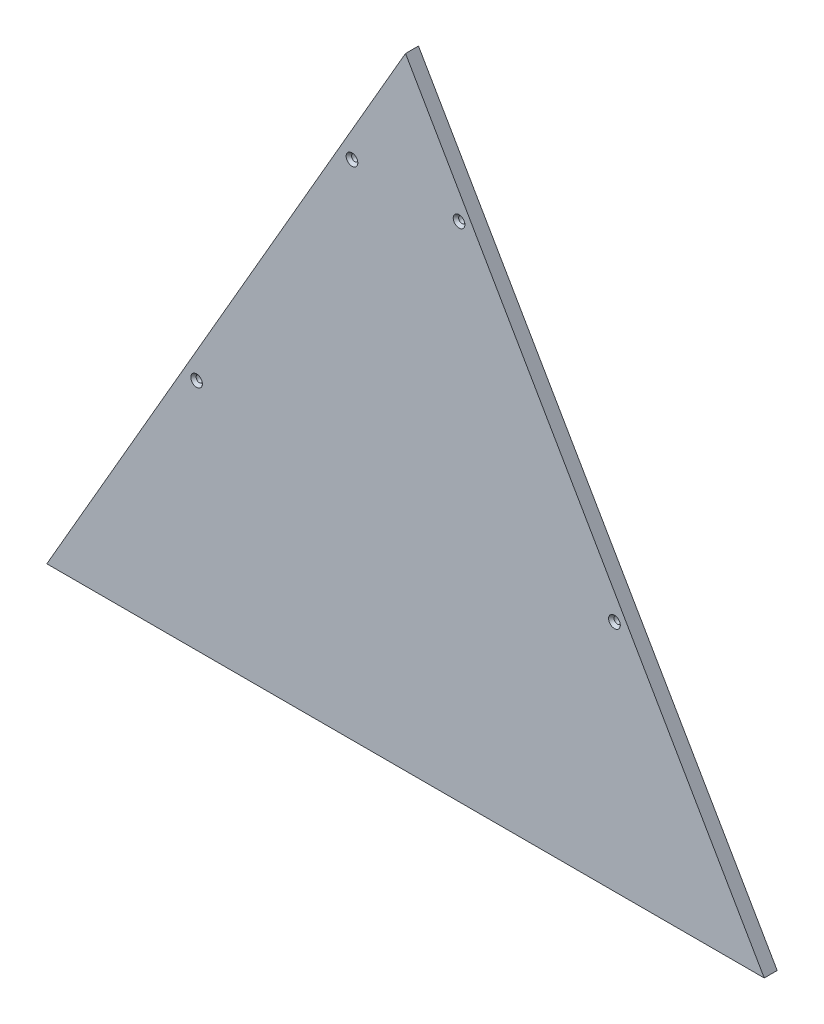
from build123d import *

# Parameters (mm, degrees)
BOSS_EXTRUDE1_DEPTH                            = 6.35
CSK_FOR_4_FLAT_HEAD_MACHINE_SCREW1_D           = 3.2639
CSK_FOR_4_FLAT_HEAD_MACHINE_SCREW1_CSINK_D     = 5.715
CSK_FOR_4_FLAT_HEAD_MACHINE_SCREW1_CSINK_ANGLE = 82


with BuildPart() as part:
    # Sketch1 → Boss-Extrude1 (new body)
    with BuildSketch(Plane.XY):
        Polygon((72.910979943, 164.398527709), (-102.984020057, -140.260549088), (248.805979943, -140.260549088), align=None)
    extrude(amount=BOSS_EXTRUDE1_DEPTH)

    # CSK for #4 Flat Head Machine Screw1 (through all)
    with Locations(Plane(origin=(46.660241257, 106.230914569, 6.35), x_dir=(1, 0, 0), z_dir=(0, 0, 1))):
        with Locations((0, 0), (-76.2, -131.982271537), (52.501477372, 0), (128.701477372, -131.982271537)):
            CounterSinkHole(CSK_FOR_4_FLAT_HEAD_MACHINE_SCREW1_D / 2, CSK_FOR_4_FLAT_HEAD_MACHINE_SCREW1_CSINK_D / 2, counter_sink_angle=CSK_FOR_4_FLAT_HEAD_MACHINE_SCREW1_CSINK_ANGLE)


solid = part.part
